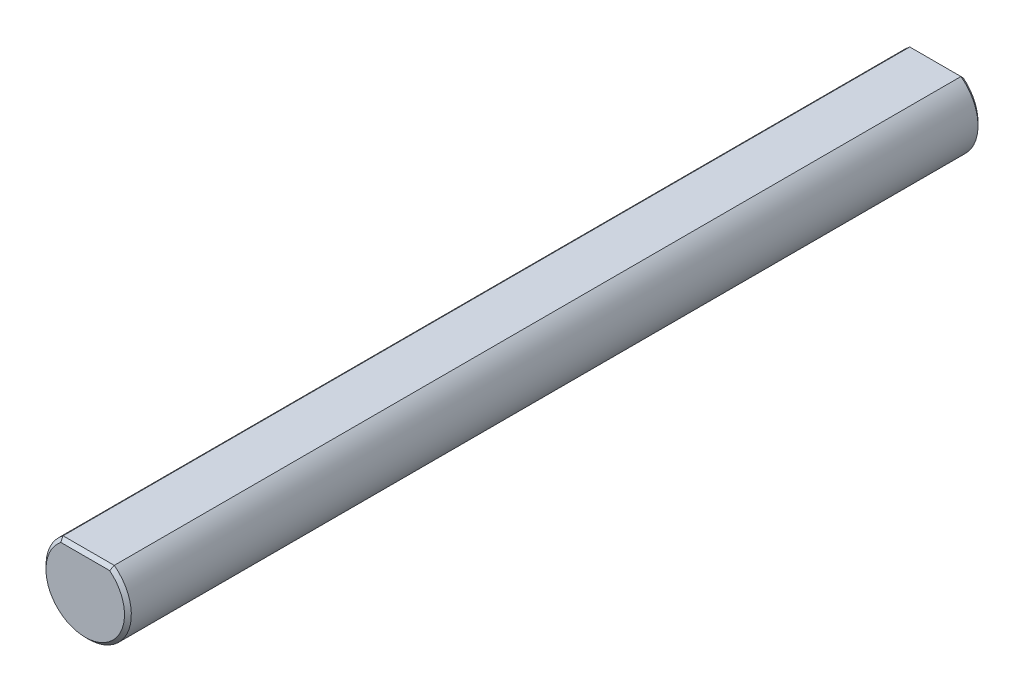
from build123d import *

# Parameters (mm, degrees)
BOSS_EXTRUDE1_DEPTH = 25
CHAMFER1_SIZE       = 0.2


with BuildPart() as part:
    # Sketch1 → Boss-Extrude1 (new, symmetric)
    with BuildSketch(Plane.XY):
        with BuildLine():
            ThreePointArc((-1.5, 2), (-2.371708245, -0.790569415), (0, -2.5))
            Line((0, -2.5), (0, 2))
            Line((0, 2), (-1.5, 2))
        make_face()
        with BuildLine():
            Line((0, 2), (0, -2.5))
            ThreePointArc((0, -2.5), (1.767766953, -1.767766953), (2.5, 0))
            ThreePointArc((2.5, 0), (2.236067977, 1.118033989), (1.5, 2))
            Line((1.5, 2), (0, 2))
        make_face()
    extrude(amount=BOSS_EXTRUDE1_DEPTH, both=True)

    # Chamfer1
    chamfer1_edges = [part.edges().sort_by_distance(p)[0] for p in [
        (-0.75, 2, -25),
        (-2.371708245, -0.790569415, 25),
        (-2.371708245, -0.790569415, -25),
        (-0.75, 2, 25),
    ]]
    chamfer(chamfer1_edges, length=CHAMFER1_SIZE)


solid = part.part
